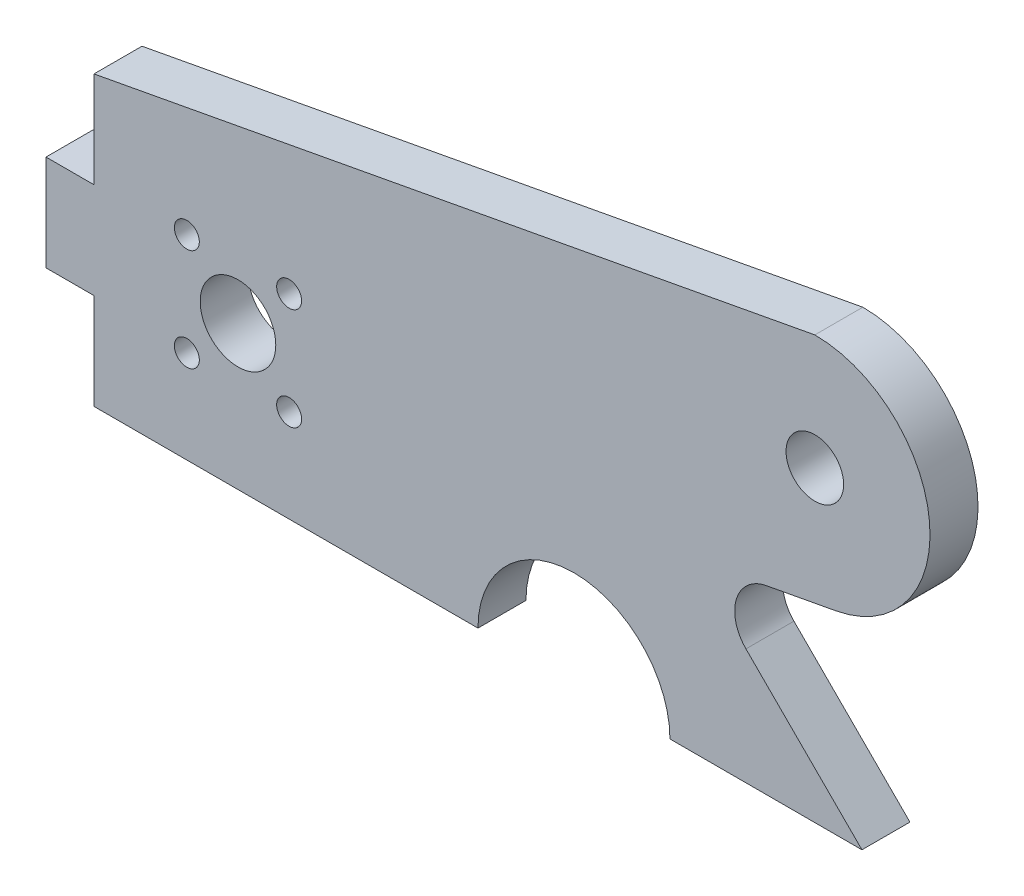
from build123d import *

# Parameters (mm, degrees)
SKETCH1_R           = 3.81
SKETCH1_R_2         = 1.651
BOSS_EXTRUDE1_DEPTH = 6.35
FILLET2_R           = 5.08
SKETCH3_R           = 1.5875
CUT_EXTRUDE1_DEPTH  = 6.35
CUT_EXTRUDE2_DEPTH  = 6.35
SKETCH7_R           = 5.000000033
CUT_EXTRUDE3_DEPTH  = 125.084268237


with BuildPart() as part:
    # Sketch1 → Boss-Extrude1 (new body)
    with BuildSketch(Plane.XY):
        with BuildLine():
            Line((0, 0), (101.6, 0))
            Line((101.6, 0), (79.43330905, 22.16669095))
            Line((79.43330905, 22.16669095), (98.16062093, 25.658150496))
            ThreePointArc((98.16062093, 25.658150496), (110.542778436, 42.04253584), (95.367453293, 55.88))
            Line((95.367453293, 55.88), (0, 38.1))
            Line((0, 38.1), (0, 25.4))
            Line((0, 25.4), (-6.35, 25.4))
            Line((-6.35, 25.4), (-6.35, 12.7))
            Line((-6.35, 12.7), (0, 12.7))
            Line((0, 12.7), (0, 0))
        make_face()
        with Locations((95.367453293, 40.64)):
            Circle(SKETCH1_R, mode=Mode.SUBTRACT)
        with Locations((25.817011896, 25.817011896)):
            Circle(SKETCH1_R_2, mode=Mode.SUBTRACT)
        with Locations((25.817011896, 12.282988104)):
            Circle(SKETCH1_R_2, mode=Mode.SUBTRACT)
        with Locations((12.282988104, 12.282988104)):
            Circle(SKETCH1_R_2, mode=Mode.SUBTRACT)
        with Locations((12.282988104, 25.817011896)):
            Circle(SKETCH1_R_2, mode=Mode.SUBTRACT)
    extrude(amount=BOSS_EXTRUDE1_DEPTH)

    # Fillet2
    fillet2_edges = [part.edges().sort_by_distance(p)[0] for p in [
        (79.43330905, 22.16669095, 3.175),
    ]]
    fillet(fillet2_edges, radius=FILLET2_R)

    # Sketch3 → Cut-Extrude1 (cut)
    with BuildSketch(Plane.ZY):
        with Locations(Location((3.175, 31.75, 0), (0, 0, 270))):
            Circle(SKETCH3_R)
        with Locations(Location((3.175, 6.35, 0), (0, 0, 270))):
            Circle(SKETCH3_R)
    extrude(amount=-CUT_EXTRUDE1_DEPTH, mode=Mode.SUBTRACT)

    # Sketch6 → Cut-Extrude2 (cut)
    with BuildSketch(Plane.XY.offset(6.35)):
        with BuildLine():
            Line((50.8, 0), (76.2, 0))
            ThreePointArc((76.2, 0), (63.5, 12.7), (50.8, 0))
        make_face()
    extrude(amount=-CUT_EXTRUDE2_DEPTH, mode=Mode.SUBTRACT)

    # Sketch7 → Cut-Extrude3 (cut, through all)
    with BuildSketch(Plane.XY.offset(6.35)):
        with Locations((19.05, 19.05)):
            Circle(SKETCH7_R)
    extrude(amount=-CUT_EXTRUDE3_DEPTH, mode=Mode.SUBTRACT)


solid = part.part
